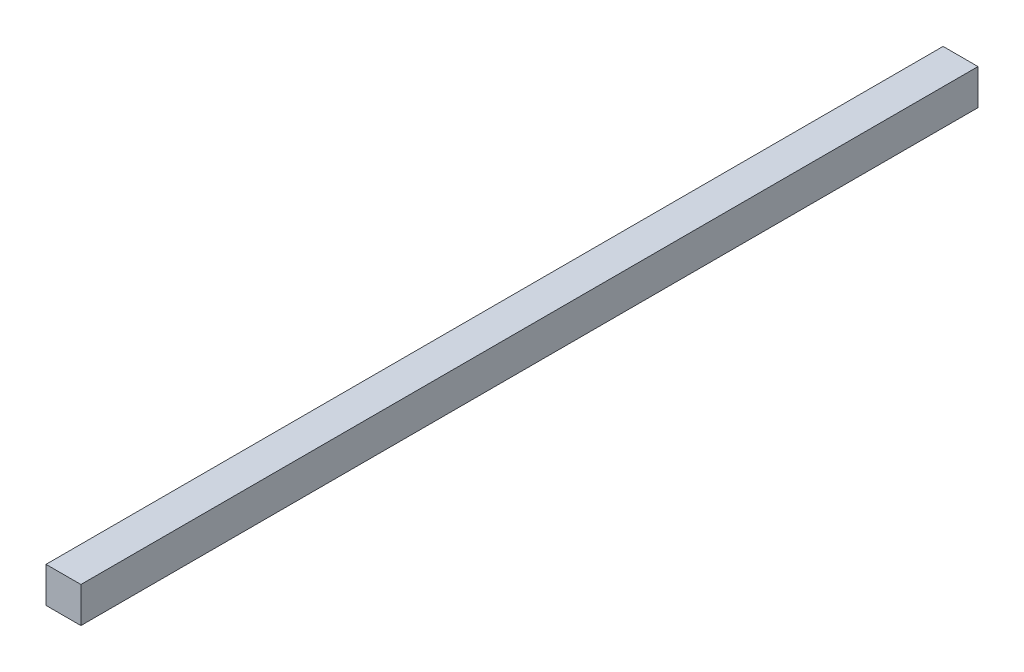
from build123d import *

# Parameters (mm, degrees)
SKETCH_1_W      = 11.67377789
SKETCH_1_H      = 11.907046198
EXTRUDE_1_DEPTH = 300


with BuildPart() as part:
    # 草图1 → 凸台-拉伸1 (new body)
    with BuildSketch(Plane.XY):
        Rectangle(SKETCH_1_W, SKETCH_1_H)
    extrude(amount=EXTRUDE_1_DEPTH)


solid = part.part
